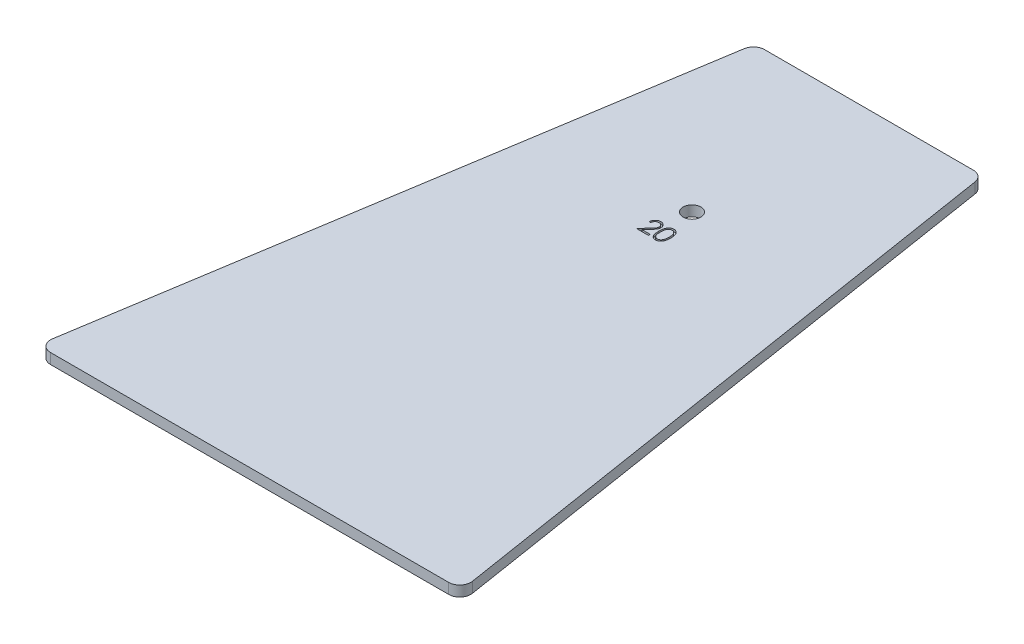
from build123d import *

# Parameters (mm, degrees)
BOSS_EXTRUDE1_DEPTH = 5.9944
SKETCH2_R           = 5.08
CUT_EXTRUDE1_DEPTH  = 376.905088197
CUT_EXTRUDE2_DEPTH  = 1.27
FILLET1_R           = 6.35


with BuildPart() as part:
    # Sketch1 → Boss-Extrude1 (new body)
    with BuildSketch(Plane(origin=(0, 0, 0), x_dir=(1, 0, 0), z_dir=(0, 1, 0))):
        Polygon((-65.405, 0), (65.405, 0), (121.726506979, -355.6), (-121.726506979, -355.6), align=None)
    extrude(amount=BOSS_EXTRUDE1_DEPTH)

    # Sketch2 → Cut-Extrude1 (cut, through all)
    with BuildSketch(Plane(origin=(0, 5.9944, 0), x_dir=(1, 0, 0), z_dir=(0, 1, 0))):
        with Locations(Location((0, -101.6, 0), (0, 0, 270))):
            Circle(SKETCH2_R)
    extrude(amount=-CUT_EXTRUDE1_DEPTH, mode=Mode.SUBTRACT)

    # Sketch3 → Cut-Extrude2 (cut)
    # profile 1 of 2: a face of its own
    with BuildSketch(Plane(origin=(0, 5.9944, 0), x_dir=(1, 0, 0), z_dir=(0, 1, 0))):
        with BuildLine():
            Line((-6.561666667, -118.696153846), (-7.473461538, -118.696153846))
            add(Edge.make_bspline(
                [(-7.473461538, -118.696153846), (-7.467518946, -118.575189212), (-7.455847852, -118.33761789), (-7.401192018, -117.991237636), (-7.3229865, -117.660152848), (-7.212412451, -117.347021898), (-7.075089084, -117.049076104), (-6.910409919, -116.767498915), (-6.71535577, -116.503364493), (-6.494138508, -116.259121451), (-6.253872973, -116.03505696), (-5.994630589, -115.841566312), (-5.722211881, -115.678084157), (-5.43744334, -115.541414038), (-5.137112104, -115.438827514), (-4.823943579, -115.36270984), (-4.496561858, -115.316913362), (-4.273506251, -115.311990739), (-4.160064103, -115.309487179)],
                knots=[0, 0, 0, 0, 1.10065271, 2.161652631, 3.183658789, 4.190468796, 5.17591951, 6.163126047, 7.15150782, 8.156236427, 9.156009102, 10.134482811, 11.092018607, 12.041330605, 13.001268258, 13.972401359, 14.968799086, 16, 16, 16, 16], degree=3))
            add(Edge.make_bspline(
                [(-4.160064103, -115.309487179), (-4.048658036, -115.31209527), (-3.829749095, -115.317220075), (-3.51025479, -115.361230377), (-3.206101273, -115.430160438), (-2.91788307, -115.526870332), (-2.647899751, -115.656873127), (-2.394123142, -115.813039696), (-2.153531988, -115.993654978), (-1.936959154, -116.206300334), (-1.738089987, -116.433310684), (-1.566524583, -116.675664141), (-1.4196018, -116.925975439), (-1.297136992, -117.186153305), (-1.206985457, -117.45864749), (-1.138541288, -117.739490799), (-1.09985371, -118.03159025), (-1.093916138, -118.229293851), (-1.090897436, -118.329807692)],
                knots=[0, 0, 0, 0, 1.111607364, 2.184268762, 3.212621178, 4.221274766, 5.211760367, 6.196651075, 7.1921475, 8.207485113, 9.220403448, 10.201281604, 11.166441695, 12.114753415, 13.065576456, 14.026450734, 14.996634279, 16, 16, 16, 16], degree=3))
            add(Edge.make_bspline(
                [(-1.090897436, -118.329807692), (-1.095812736, -118.471315692), (-1.10555708, -118.751848427), (-1.188910813, -119.164097285), (-1.319093828, -119.563511325), (-1.475840441, -119.884965893), (-1.633966164, -120.143997978), (-1.776460186, -120.357267133), (-1.943272324, -120.586899007), (-2.136830478, -120.832124649), (-2.353130701, -121.094864876), (-2.594132181, -121.374960968), (-2.861553489, -121.66951902), (-3.049247879, -121.87070328), (-3.14650641, -121.974951923)],
                knots=[0, 0, 0, 0, 1.184426356, 2.348067706, 3.509069118, 4.696110526, 5.333549288, 6.050745305, 6.844228056, 7.710549037, 8.667450064, 9.695053472, 10.805634456, 12, 12, 12, 12], degree=3))
            Line((-3.14650641, -121.974951923), (-5.688541667, -124.687948718))
            Line((-5.688541667, -124.687948718), (-0.960641026, -124.687948718))
            Line((-0.960641026, -124.687948718), (-0.960641026, -125.73))
            Line((-0.960641026, -125.73), (-7.864230769, -125.73))
            Line((-7.864230769, -125.73), (-3.923974359, -121.525160256))
            add(Edge.make_bspline(
                [(-3.923974359, -121.525160256), (-3.828041065, -121.425016601), (-3.64377284, -121.232661133), (-3.383146845, -120.951830141), (-3.149063382, -120.691300045), (-2.940007179, -120.451563093), (-2.760513346, -120.229112599), (-2.601227096, -120.031153117), (-2.473601266, -119.848985912), (-2.335090289, -119.637830302), (-2.200937703, -119.380020832), (-2.085658406, -119.064963037), (-2.015366161, -118.740634784), (-2.006933838, -118.521463156), (-2.002692308, -118.411217949)],
                knots=[0, 0, 0, 0, 1.329631726, 2.553950428, 3.673215718, 4.687767853, 5.603093632, 6.413772471, 7.123043292, 7.734684054, 8.834405432, 9.900288307, 10.943827018, 12, 12, 12, 12], degree=3))
            add(Edge.make_bspline(
                [(-2.002692308, -118.411217949), (-2.004537777, -118.341893661), (-2.008174842, -118.205268801), (-2.040273758, -118.004954941), (-2.08878197, -117.811726796), (-2.158291633, -117.624990004), (-2.250041485, -117.446622054), (-2.36172421, -117.276405826), (-2.490582223, -117.111845858), (-2.639647622, -116.957549427), (-2.803402205, -116.816234842), (-2.976395798, -116.691051783), (-3.159421244, -116.586435393), (-3.351706856, -116.500674841), (-3.552716561, -116.43340002), (-3.762839135, -116.386784258), (-3.981493994, -116.357516248), (-4.130798085, -116.353556251), (-4.206875, -116.351538462)],
                knots=[0, 0, 0, 0, 0.991446411, 1.95395049, 2.89581595, 3.838931463, 4.798493298, 5.75982156, 6.748411868, 7.785213223, 8.824556874, 9.840280684, 10.836137867, 11.835679398, 12.848801643, 13.863922112, 14.911575587, 16, 16, 16, 16], degree=3))
            add(Edge.make_bspline(
                [(-4.206875, -116.351538462), (-4.286328617, -116.353614098), (-4.442362403, -116.357690305), (-4.671453081, -116.386204096), (-4.889996938, -116.43539545), (-5.09854372, -116.502674024), (-5.297446289, -116.588187983), (-5.485737342, -116.694698876), (-5.662994187, -116.821796102), (-5.829550037, -116.965895546), (-5.983006616, -117.126329497), (-6.117835262, -117.305174418), (-6.235644857, -117.499164858), (-6.338432803, -117.707777382), (-6.421906464, -117.932904926), (-6.48569138, -118.173748321), (-6.536162913, -118.429261817), (-6.553024218, -118.605712234), (-6.561666667, -118.696153846)],
                knots=[0, 0, 0, 0, 1.031018746, 2.02475058, 2.990194455, 3.934040569, 4.864654155, 5.795059489, 6.735614925, 7.690564532, 8.649604399, 9.611025574, 10.590972636, 11.591080095, 12.624614302, 13.701020113, 14.821632451, 16, 16, 16, 16], degree=3))
        make_face()
    # profile 2 of 2: a face of its own
    with BuildSketch(Plane(origin=(0, 5.9944, 0), x_dir=(1, 0, 0), z_dir=(0, 1, 0))):
        with BuildLine():
            add(Edge.make_bspline(
                [(-0.048846154, -120.654070513), (-0.047893964, -120.49122781), (-0.046044321, -120.174903513), (-0.025467648, -119.713974381), (0.008714488, -119.281563942), (0.055558976, -118.877651499), (0.112565228, -118.502132776), (0.18866504, -118.15601131), (0.275207347, -117.837685138), (0.375508161, -117.54611622), (0.488684143, -117.277376373), (0.61186474, -117.02649636), (0.749938543, -116.79385578), (0.895014382, -116.575741508), (1.052964853, -116.375723925), (1.219295056, -116.190978368), (1.400496845, -116.025774589), (1.590410492, -115.87527218), (1.790755429, -115.743338857), (1.995820997, -115.627129536), (2.207018675, -115.527852207), (2.424925081, -115.449793113), (2.647581649, -115.385318198), (2.875766734, -115.341226852), (3.109857093, -115.313484512), (3.267863772, -115.310832265), (3.347996795, -115.309487179)],
                knots=[0, 0, 0, 0, 1.646270934, 3.197905019, 4.663502075, 6.030701355, 7.308322542, 8.50163776, 9.611534131, 10.641858119, 11.616356847, 12.558055219, 13.465016945, 14.349605745, 15.204443733, 16.039544428, 16.859896111, 17.680448484, 18.487036065, 19.28249412, 20.06191084, 20.843045899, 21.620316918, 22.403196591, 23.190181807, 24, 24, 24, 24], degree=3))
            add(Edge.make_bspline(
                [(3.347996795, -115.309487179), (3.428799212, -115.310903237), (3.589489798, -115.313719331), (3.827060716, -115.340785404), (4.059143221, -115.385695864), (4.284747875, -115.449329322), (4.505727836, -115.528274486), (4.720354665, -115.627224517), (4.929961507, -115.742406601), (5.131217428, -115.877749056), (5.326331854, -116.028646178), (5.510512226, -116.199225811), (5.68377531, -116.387765567), (5.848295625, -116.592248235), (5.999405587, -116.816595795), (6.143310179, -117.05690624), (6.27211586, -117.317382122), (6.396168518, -117.593677423), (6.50324617, -117.893437072), (6.599813328, -118.214971348), (6.677839134, -118.562078131), (6.742831993, -118.93293626), (6.793181748, -119.328907697), (6.829852504, -119.74914363), (6.849223516, -120.193920536), (6.85287154, -120.498017606), (6.85474359, -120.654070513)],
                knots=[0, 0, 0, 0, 0.810914788, 1.612654377, 2.396697861, 3.181598691, 3.963628158, 4.749916497, 5.551656086, 6.361998678, 7.18212741, 8.025565596, 8.878627764, 9.750805457, 10.657531673, 11.591944965, 12.560506719, 13.57287815, 14.630710178, 15.753379473, 16.941251878, 18.199788006, 19.531962791, 20.947069417, 22.433333509, 24, 24, 24, 24], degree=3))
            add(Edge.make_bspline(
                [(6.85474359, -120.654070513), (6.852852133, -120.809442771), (6.849166706, -121.112179281), (6.83006966, -121.554954912), (6.792452605, -121.97296066), (6.745397325, -122.367199031), (6.680225387, -122.736029148), (6.600091533, -123.080727318), (6.511118024, -123.402782109), (6.401289022, -123.699555162), (6.281079646, -123.975186449), (6.150290848, -124.232574514), (6.010170438, -124.473994381), (5.857512824, -124.697513646), (5.694797773, -124.904715691), (5.518542706, -125.091943075), (5.333716093, -125.263707083), (5.138027481, -125.416547236), (4.933632806, -125.55032484), (4.724745886, -125.66996276), (4.507660407, -125.766432526), (4.28729595, -125.849265674), (4.060500465, -125.912549271), (3.827556656, -125.956306521), (3.589649411, -125.986995086), (3.428826582, -125.989336182), (3.347996795, -125.990512821)],
                knots=[0, 0, 0, 0, 1.561518951, 3.042555995, 4.452378317, 5.7783523, 7.031515105, 8.214008947, 9.334062868, 10.386615937, 11.391082383, 12.354592575, 13.286541444, 14.194233754, 15.072674879, 15.931287219, 16.775624067, 17.606195743, 18.42308326, 19.229000347, 20.022332153, 20.807536673, 21.593273796, 22.3848459, 23.188221202, 24, 24, 24, 24], degree=3))
            add(Edge.make_bspline(
                [(3.347996795, -125.990512821), (3.267865995, -125.989159057), (3.1098637, -125.9864897), (2.87574123, -125.958872697), (2.64849848, -125.914472036), (2.427014097, -125.852302694), (2.210151756, -125.776204769), (2.000866535, -125.677061505), (1.796831431, -125.562880322), (1.5985908, -125.432845613), (1.409869783, -125.283866098), (1.229606403, -125.119087477), (1.062329205, -124.934397803), (0.906637088, -124.732713318), (0.758666592, -124.515889506), (0.622553439, -124.280966), (0.496654046, -124.028874308), (0.381574656, -123.757985744), (0.279543107, -123.46434744), (0.189416046, -123.14460011), (0.118254948, -122.795921578), (0.057344427, -122.421112306), (0.00821536, -122.018561697), (-0.025325195, -121.588051209), (-0.046055413, -121.129849117), (-0.047898931, -120.81555743), (-0.048846154, -120.654070513)],
                knots=[0, 0, 0, 0, 0.810891512, 1.598919785, 2.382837074, 3.152667961, 3.926044502, 4.706494248, 5.493654104, 6.291793342, 7.103789334, 7.925228297, 8.761435821, 9.622817696, 10.50288917, 11.416980706, 12.369136599, 13.353924996, 14.394355917, 15.514179734, 16.714354668, 17.994756427, 19.357759367, 20.818452758, 22.365282078, 24, 24, 24, 24], degree=3))
        make_face()
        with BuildLine():
            add(Edge.make_bspline(
                [(0.862948718, -120.65), (0.863295456, -120.785704794), (0.863968406, -121.049081153), (0.881548691, -121.431803305), (0.905497936, -121.788768602), (0.936388101, -122.120430297), (0.982261803, -122.425665761), (1.033662079, -122.706574327), (1.096213105, -122.961669393), (1.170221499, -123.192701437), (1.254517849, -123.403591305), (1.346555442, -123.599827975), (1.445428855, -123.783729596), (1.556083303, -123.953644299), (1.676595601, -124.110126193), (1.80424369, -124.255944929), (1.943791535, -124.385984166), (2.136842399, -124.541945551), (2.391703022, -124.703109665), (2.712818401, -124.843451457), (3.042781675, -124.931647388), (3.266740733, -124.942863319), (3.378525641, -124.948461538)],
                knots=[0, 0, 0, 0, 1.459021318, 2.831673884, 4.118529203, 5.306027144, 6.411944654, 7.436330062, 8.375795394, 9.233974572, 10.042671642, 10.816086306, 11.563610507, 12.285937304, 12.993564865, 13.685989202, 14.367179055, 15.041617293, 16.353048772, 17.594441528, 18.799311195, 20, 20, 20, 20], degree=3))
            add(Edge.make_bspline(
                [(3.378525641, -124.948461538), (3.491033625, -124.943823409), (3.715817306, -124.934556726), (4.044228551, -124.845152391), (4.363050135, -124.710257957), (4.612904682, -124.550753198), (4.802991151, -124.398851533), (4.939184471, -124.269341583), (5.064187446, -124.124326837), (5.182746155, -123.96786488), (5.2914845, -123.796966469), (5.390364923, -123.612453394), (5.48059544, -123.413813266), (5.532002271, -123.275144537), (5.558285256, -123.204246795)],
                knots=[0, 0, 0, 0, 1.353760809, 2.704726607, 4.075137775, 5.516104923, 6.260822281, 7.007110065, 7.778089737, 8.566572457, 9.372053459, 10.217411131, 11.088608312, 12, 12, 12, 12], degree=3))
            add(Edge.make_bspline(
                [(5.558285256, -123.204246795), (5.588915531, -123.113591323), (5.651108124, -122.929521836), (5.73126116, -122.643986205), (5.794384948, -122.344403325), (5.851174604, -122.032563558), (5.889936617, -121.706167168), (5.921135984, -121.366224065), (5.939513064, -121.01247794), (5.941791084, -120.772135908), (5.942948718, -120.65)],
                knots=[0, 0, 0, 0, 0.884706709, 1.796334032, 2.740027952, 3.714592787, 4.726048262, 5.777819803, 6.87074269, 8, 8, 8, 8], degree=3))
            add(Edge.make_bspline(
                [(5.942948718, -120.65), (5.941351597, -120.527883847), (5.938227288, -120.288998545), (5.926284969, -119.939151484), (5.89544625, -119.606867926), (5.861195093, -119.290716383), (5.810693446, -118.992446933), (5.756242212, -118.709562618), (5.683086693, -118.445568009), (5.604942432, -118.196329909), (5.515504255, -117.964680009), (5.417051724, -117.749538275), (5.311905133, -117.549866045), (5.197700229, -117.366211152), (5.07579276, -117.19775097), (4.942965132, -117.047863119), (4.804486153, -116.911902091), (4.610525407, -116.756707891), (4.35660004, -116.598468226), (4.040636676, -116.452844192), (3.711828177, -116.369217834), (3.489546379, -116.357427336), (3.378525641, -116.351538462)],
                knots=[0, 0, 0, 0, 1.31362396, 2.569729283, 3.763502607, 4.902122613, 5.988968491, 7.01645872, 7.998833611, 8.933434873, 9.825090667, 10.667526885, 11.477055099, 12.250526234, 12.991942729, 13.710640831, 14.402115721, 15.076753259, 16.378508321, 17.609869233, 18.806226677, 20, 20, 20, 20], degree=3))
            add(Edge.make_bspline(
                [(3.378525641, -116.351538462), (3.266154322, -116.357435461), (3.041206971, -116.369240203), (2.708980908, -116.452532619), (2.390524848, -116.597713114), (2.137270955, -116.757232001), (1.943174935, -116.909162642), (1.806500602, -117.040913035), (1.678350571, -117.185029019), (1.560298047, -117.342950006), (1.449730299, -117.512666615), (1.348185417, -117.695514001), (1.256695112, -117.892418761), (1.172266858, -118.103213899), (1.098032708, -118.334226012), (1.036799946, -118.589006862), (0.980231814, -118.869021954), (0.940186119, -119.175910582), (0.904586188, -119.507655348), (0.881707761, -119.865511791), (0.863909597, -120.248875821), (0.863275426, -120.51361395), (0.862948718, -120.65)],
                knots=[0, 0, 0, 0, 1.207732386, 2.417664972, 3.655092373, 4.956220595, 5.625982001, 6.301752483, 6.994047911, 7.697131622, 8.419323945, 9.170223765, 9.943494443, 10.752040957, 11.610060368, 12.549350801, 13.567764191, 14.679664412, 15.874934091, 17.154273443, 18.533957287, 20, 20, 20, 20], degree=3))
        make_face(mode=Mode.SUBTRACT)
    extrude(amount=-CUT_EXTRUDE2_DEPTH, mode=Mode.SUBTRACT)

    # Fillet1
    fillet1_edges = [part.edges().sort_by_distance(p)[0] for p in [
        (121.726506979, 2.9972, 355.6),
        (-121.726506979, 2.9972, 355.6),
        (-65.405, 2.9972, 0),
        (65.405, 2.9972, 0),
    ]]
    fillet(fillet1_edges, radius=FILLET1_R)


solid = part.part
